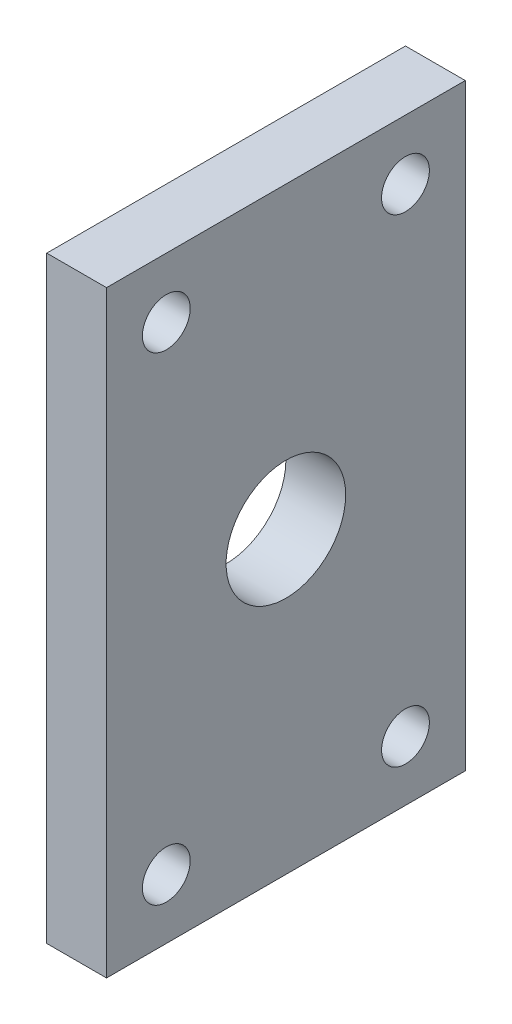
from build123d import *

# Parameters (mm, degrees)
SKETCH1_W           = 100
SKETCH1_H           = 60
BOSS_EXTRUDE1_DEPTH = 10
SKETCH2_R           = 4
CUT_EXTRUDE2_DEPTH  = 118.046999107
SKETCH3_R           = 10
CUT_EXTRUDE4_DEPTH  = 118.046999107


with BuildPart() as part:
    # Sketch1 → Boss-Extrude1 (new body)
    with BuildSketch(Plane.YZ):
        with Locations((50, 30)):
            Rectangle(SKETCH1_W, SKETCH1_H)
    extrude(amount=BOSS_EXTRUDE1_DEPTH)

    # Sketch2 → Cut-Extrude2 (cut, through all)
    with BuildSketch(Plane.YZ):
        with Locations(Location((10, 10, 0), (0, 0, 270))):
            Circle(SKETCH2_R)
        with Locations(Location((90, 10, 0), (0, 0, 270))):
            Circle(SKETCH2_R)
        with Locations(Location((10, 50, 0), (0, 0, 270))):
            Circle(SKETCH2_R)
        with Locations(Location((90, 50, 0), (0, 0, 270))):
            Circle(SKETCH2_R)
    extrude(amount=CUT_EXTRUDE2_DEPTH, mode=Mode.SUBTRACT)

    # Sketch3 → Cut-Extrude4 (cut, through all)
    with BuildSketch(Plane.YZ):
        with Locations(Location((50, 30, 0), (0, 0, 270))):
            Circle(SKETCH3_R)
    extrude(amount=CUT_EXTRUDE4_DEPTH, mode=Mode.SUBTRACT)


solid = part.part
